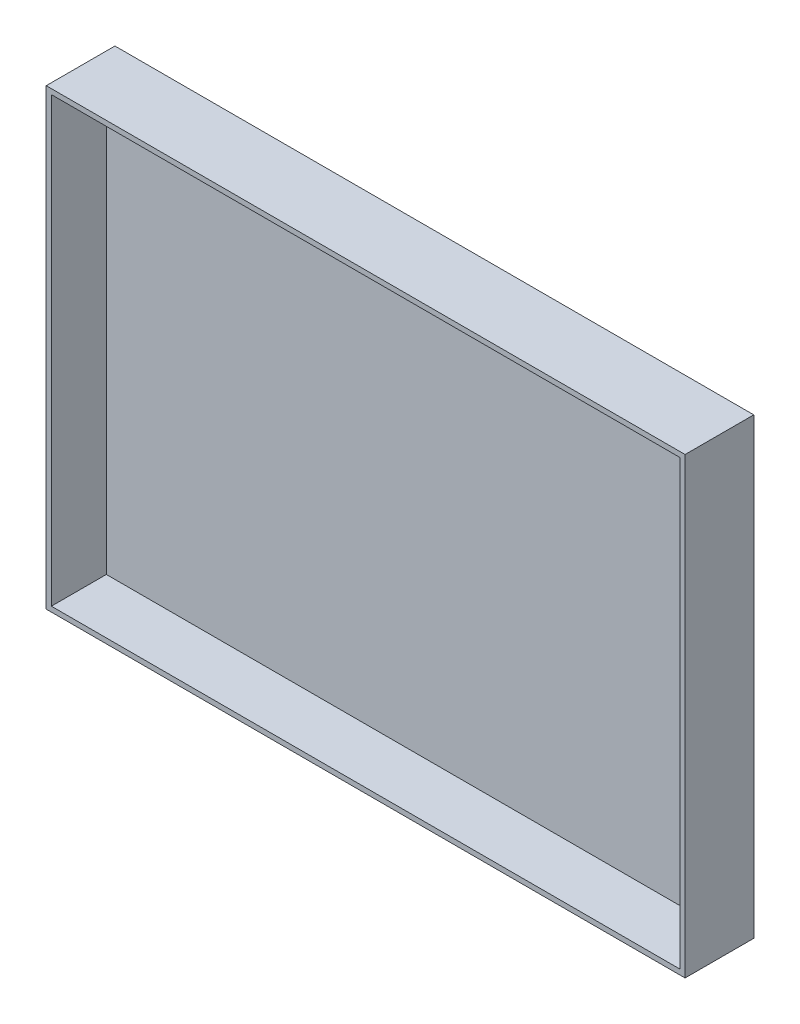
from build123d import *

# Parameters (mm, degrees)
SKETCH1_W           = 93
SKETCH1_H           = 66
SKETCH1_W_2         = 91.5
SKETCH1_H_2         = 64.5
BOSS_EXTRUDE1_DEPTH = 10
SKETCH2_W           = 93
SKETCH2_H           = 66
BOSS_EXTRUDE2_DEPTH = 2


with BuildPart() as part:
    # Sketch1 → Boss-Extrude1 (new body)
    with BuildSketch(Plane.XY):
        Rectangle(SKETCH1_W, SKETCH1_H)
        Rectangle(SKETCH1_W_2, SKETCH1_H_2, mode=Mode.SUBTRACT)
    extrude(amount=BOSS_EXTRUDE1_DEPTH)

    # Sketch2 → Boss-Extrude2 (add)
    with BuildSketch(Plane.XY):
        Rectangle(SKETCH2_W, SKETCH2_H)
    extrude(amount=BOSS_EXTRUDE2_DEPTH)


solid = part.part
